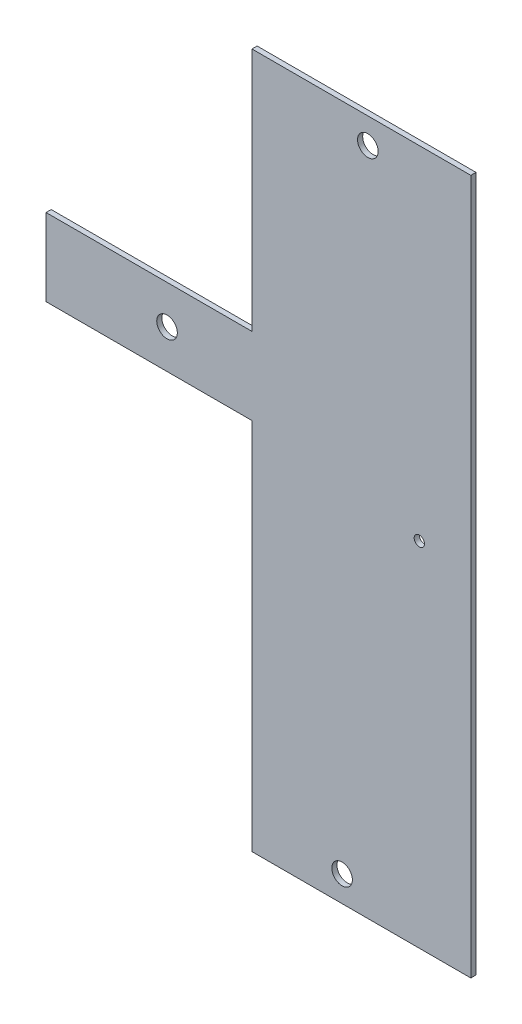
from build123d import *

# Parameters (mm, degrees)
EXTRUDE2_DEPTH     = 2
SKETCH3_R          = 4
SKETCH3_R_2        = 2
CUT_EXTRUDE1_DEPTH = 2


with BuildPart() as part:
    # Sketch2 → Extrude2 (new body)
    with BuildSketch(Plane.XY):
        Polygon((-71.596139955, 14.603160243), (8.403860045, 14.603160243), (8.403860045, 109.603160243), (93.403860045, 109.603160243), (93.403860045, -160.396839757), (8.403860045, -160.396839757), (8.403860045, -15.396839757), (-71.596139955, -15.396839757), align=None)
    extrude(amount=EXTRUDE2_DEPTH)

    # Sketch3 → Cut-Extrude1 (cut)
    with BuildSketch(Plane(origin=(0, 0, 0), x_dir=(-1, 0, 0), z_dir=(0, 0, -1))):
        with Locations((-53.403860045, 99.603160243)):
            Circle(SKETCH3_R)
        with Locations((24.596139955, -0.396839757)):
            Circle(SKETCH3_R)
        with Locations((-73.403960045, -23.396839757)):
            Circle(SKETCH3_R_2)
        with Locations((-43.403860045, -150.396839757)):
            Circle(SKETCH3_R)
    extrude(amount=-CUT_EXTRUDE1_DEPTH, mode=Mode.SUBTRACT)


solid = part.part
